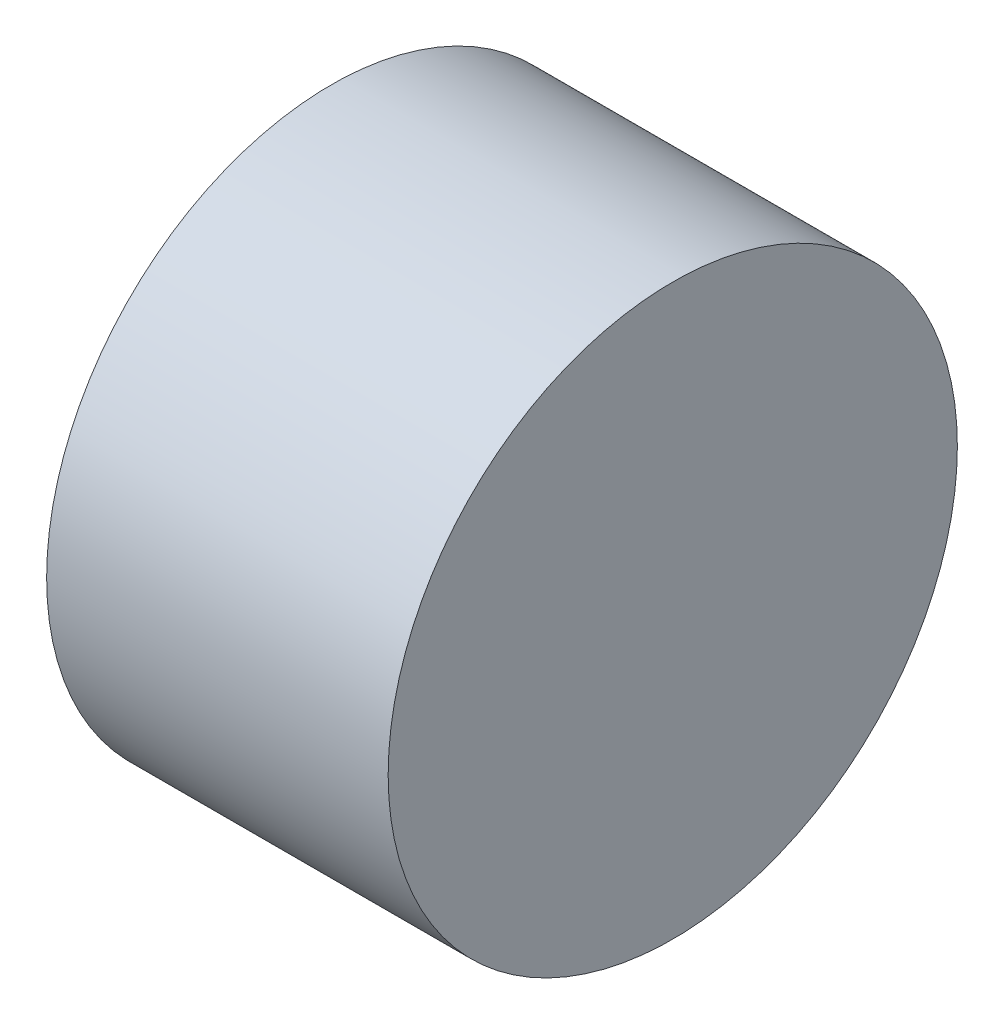
from build123d import *

# Parameters (mm, degrees)
EXTRUDE_1_DEPTH      = 30
EXTRUDE_1_DEPTH_BACK = 30
SKETCH_1_R           = 50


with BuildPart() as part:
    # 草图1 → 凸台-拉伸1 (new, two sides: drawn at the far end of the back side and taken through both)
    with BuildSketch(Plane(origin=(0, 0, 0), x_dir=(0, 0, -1), z_dir=(1, 0, 0)).offset(-EXTRUDE_1_DEPTH_BACK)):
        Circle(SKETCH_1_R)
    extrude(amount=EXTRUDE_1_DEPTH + EXTRUDE_1_DEPTH_BACK)


solid = part.part
